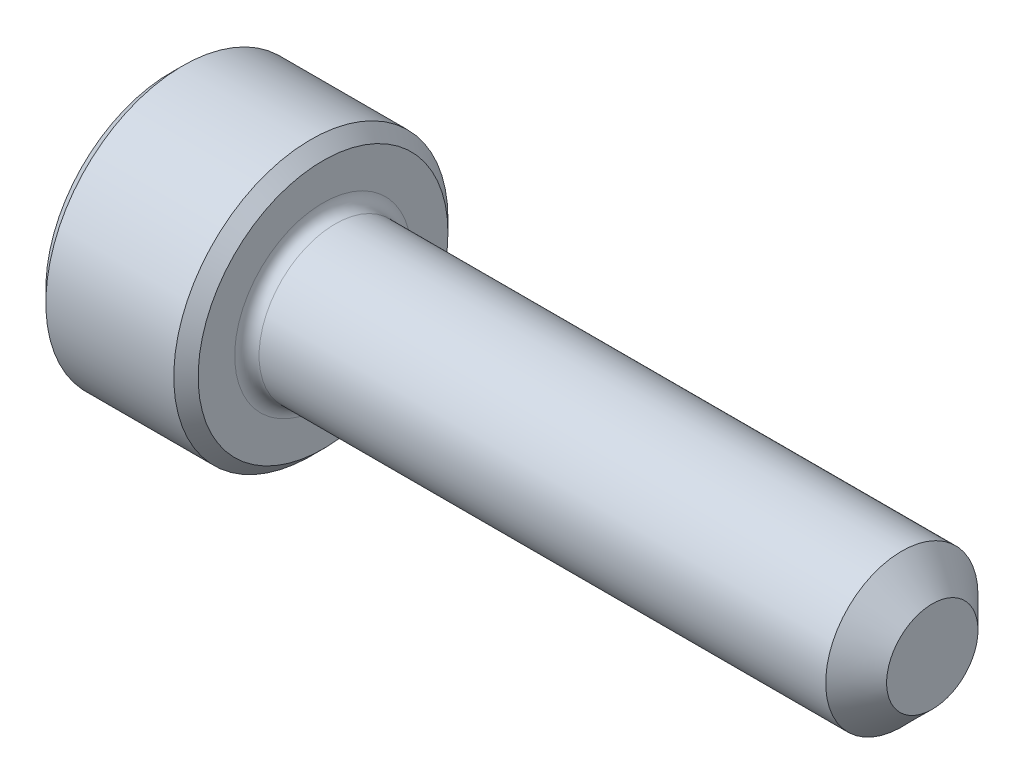
from build123d import *

# Parameters (mm, degrees)
CUT_EXTRUDE_1_DEPTH = 1.1


with BuildPart() as part:
    # Эскиз1 → Повернуть1 (revolve)
    with BuildSketch(Plane.XY, mode=Mode.PRIVATE) as revolve_1_sk:
        with BuildLine():
            Line((0, 0), (0, 2.05))
            Line((0, 2.05), (0.2, 2.25))
            Line((0.2, 2.25), (2.3, 2.25))
            Line((2.3, 2.25), (2.5, 2.05))
            Line((2.5, 2.05), (2.5, 1.45))
            ThreePointArc((2.5, 1.45), (2.558578644, 1.308578644), (2.7, 1.25))
            Line((2.7, 1.25), (12, 1.25))
            Line((12, 1.25), (12.5, 0.75))
            Line((12.5, 0.75), (12.5, 0))
            Line((12.5, 0), (0, 0))
        make_face()
    revolve(revolve_1_sk.sketch.rotate(Axis((0, 0, 0), (-1, 0, 0)), 90), axis=Axis((0, 0, 0), (-1, 0, 0)))

    # Эскиз2 → Вырез-Вытянуть1 (cut)
    with BuildSketch(Plane.ZY):
        Polygon((0, 1.154700538), (-1, 0.577350269), (-1, -0.577350269), (0, -1.154700538), (1, -0.577350269), (1, 0.577350269), align=None)
    extrude(amount=-CUT_EXTRUDE_1_DEPTH, mode=Mode.SUBTRACT)


solid = part.part
